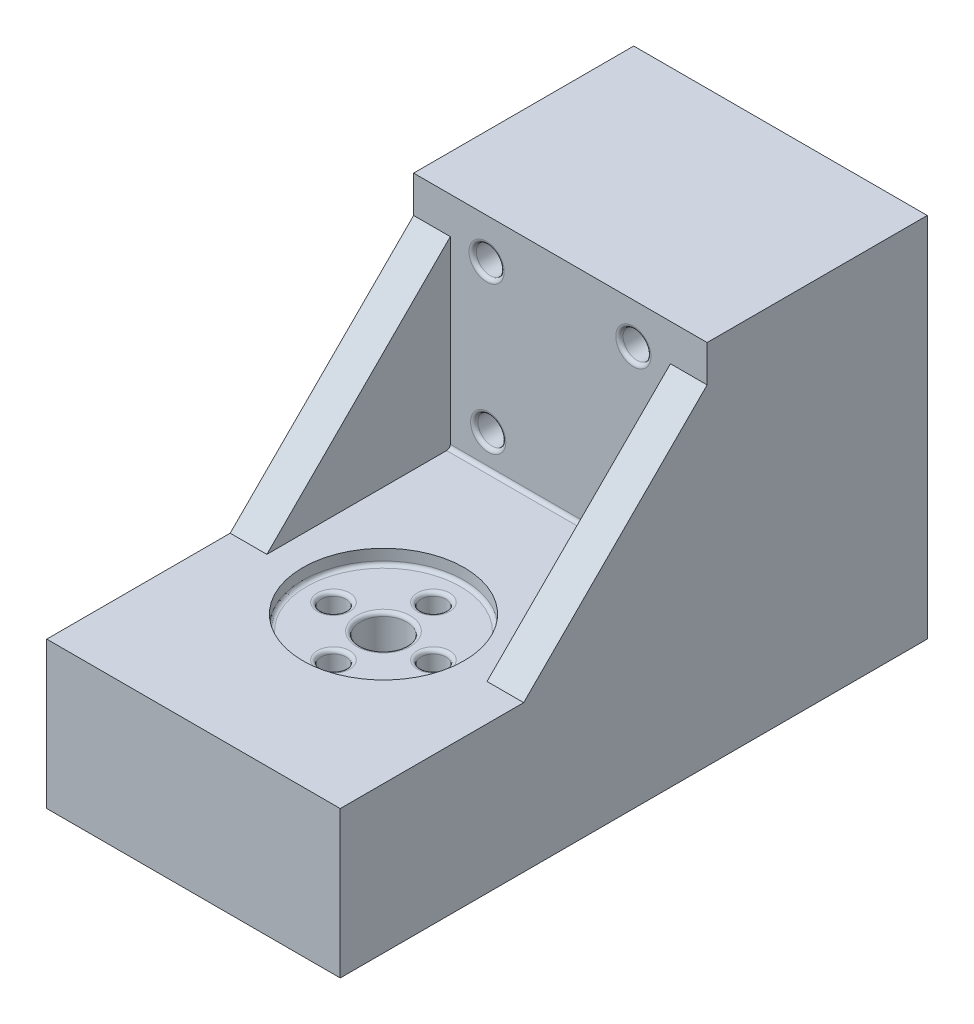
from build123d import *

# Parameters (mm, degrees)
SKETCH2_W           = 40
SKETCH2_H           = 20
BOSS_EXTRUDE1_DEPTH = 50
SKETCH3_R           = 3.15
CUT_EXTRUDE2_DEPTH  = 68.082039325
SKETCH5_R           = 11
CUT_EXTRUDE4_DEPTH  = 2
SKETCH9_W           = 40
SKETCH9_H           = 50
BOSS_EXTRUDE2_DEPTH = 30
SKETCH10_R          = 1.7
CUT_EXTRUDE5_DEPTH  = 72.582120673
SKETCH11_R          = 1.89724105
CUT_EXTRUDE6_DEPTH  = 82.240384046
SKETCH11_3_R        = 1.89724105
CUT_EXTRUDE7_DEPTH  = 82.240384046
GUSSET1_THICKNESS   = 5
GUSSET2_THICKNESS   = 5
FILLET7_R           = 0.5
FILLET8_R           = 0.5


with BuildPart() as part:
    # Sketch2 → Boss-Extrude1 (new body)
    with BuildSketch(Plane.XY):
        with Locations((20, 10)):
            Rectangle(SKETCH2_W, SKETCH2_H)
    extrude(amount=BOSS_EXTRUDE1_DEPTH)

    # Sketch3 → Cut-Extrude2 (cut, through all)
    with BuildSketch(Plane(origin=(0, 20, 0), x_dir=(1, 0, 0), z_dir=(0, 1, 0))):
        with Locations(Location((20, -24.109049032, 0), (0, 0, 270))):
            Circle(SKETCH3_R)
    extrude(amount=-CUT_EXTRUDE2_DEPTH, mode=Mode.SUBTRACT)

    # Sketch5 → Cut-Extrude4 (cut)
    with BuildSketch(Plane(origin=(0, 20, 0), x_dir=(1, 0, 0), z_dir=(0, 1, 0))):
        with Locations(Location((20, -24.109049032, 0), (0, 0, 270))):
            Circle(SKETCH5_R)
    extrude(amount=-CUT_EXTRUDE4_DEPTH, mode=Mode.SUBTRACT)

    # Sketch9 → Boss-Extrude2 (add)
    with BuildSketch(Plane(origin=(0, 0, 0), x_dir=(-1, 0, 0), z_dir=(0, 0, -1))):
        with Locations((-20, 25)):
            Rectangle(SKETCH9_W, SKETCH9_H)
    extrude(amount=BOSS_EXTRUDE2_DEPTH)

    # Sketch10 → Cut-Extrude5 (cut, through all)
    with BuildSketch(Plane(origin=(0, 18, 0), x_dir=(1, 0, 0), z_dir=(0, 1, 0))):
        with Locations(Location((20, -17.297080962, 0), (0, 0, 270))):
            Circle(SKETCH10_R)
        with Locations(Location((26.81196807, -24.109049032, 0), (0, 0, 270))):
            Circle(SKETCH10_R)
        with Locations(Location((20, -30.921017102, 0), (0, 0, 270))):
            Circle(SKETCH10_R)
        with Locations(Location((13.18803193, -24.109049032, 0), (0, 0, 270))):
            Circle(SKETCH10_R)
    extrude(amount=-CUT_EXTRUDE5_DEPTH, mode=Mode.SUBTRACT)

    # Sketch11 → Cut-Extrude6 (cut, through all)
    with BuildSketch(Plane.XY):
        with Locations((9.945952342, 44.519691573)):
            Circle(SKETCH11_R)
    extrude(amount=-CUT_EXTRUDE6_DEPTH, mode=Mode.SUBTRACT)

    # Sketch11<3> → Cut-Extrude7 (cut, through all)
    with BuildSketch(Plane.XY):
        with Locations((9.945952342, 44.519691573)):
            Circle(SKETCH11_3_R)
        with Locations((29.945952342, 44.519691573)):
            Circle(SKETCH11_3_R)
        with Locations((30.162546138, 24.520864429)):
            Circle(SKETCH11_3_R)
        with Locations((10.162546138, 24.520864429)):
            Circle(SKETCH11_3_R)
    extrude(amount=-CUT_EXTRUDE7_DEPTH, mode=Mode.SUBTRACT)

    # Fillet7
    fillet7_edges = [part.edges().sort_by_distance(p)[0] for p in [
        (20, 18, 13.109049032),
        (20, 20, 0),
        (8.048711292, 44.519691573, 0),
        (8.265305088, 24.520864429, 0),
        (28.265305088, 24.520864429, 0),
        (28.048711292, 44.519691573, 0),
    ]]
    fillet(fillet7_edges, radius=FILLET7_R)

    # Fillet8
    fillet8_edges = [part.edges().sort_by_distance(p)[0] for p in [
        (20, 18, 20.959049032),
        (20, 18, 15.597080962),
        (26.81196807, 18, 22.409049032),
        (20, 18, 29.221017102),
        (13.18803193, 18, 22.409049032),
    ]]
    fillet(fillet8_edges, radius=FILLET8_R)


with BuildPart() as body_2:
    # Gusset1: a gusset: a plate 5.0 thick in the corner of two members, its outline drawn in place
    gusset1_outline = Wire([Line((0, 20, 0), (0, 20, 25)), Line((0, 20, 25), (0, 45, 0)), Line((0, 45, 0), (0, 20, 0))])
    add(extrude(Face(gusset1_outline), amount=GUSSET1_THICKNESS, dir=(1, 0, 0)))


with BuildPart() as body_3:
    # Gusset2: a gusset: a plate 5.0 thick in the corner of two members, its outline drawn in place
    gusset2_outline = Wire([Line((35, 20, 0), (35, 20, 25)), Line((35, 20, 25), (35, 45, 0)), Line((35, 45, 0), (35, 20, 0))])
    add(extrude(Face(gusset2_outline), amount=GUSSET2_THICKNESS, dir=(1, 0, 0)))


with BuildPart() as body_2_1:
    add(body_2.part)

    # Combine1: union body 3, part
    add(body_3.part)
    add(part.part)


solid = body_2_1.part
